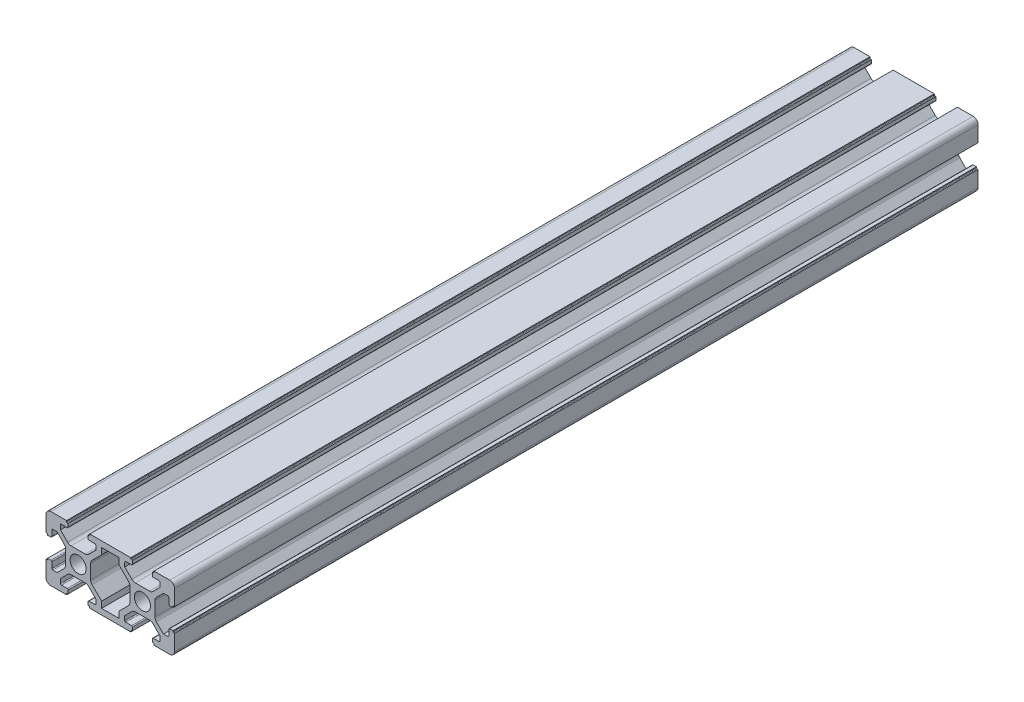
from build123d import *

# Parameters (mm, degrees)
SKETCH_1_R      = 2.5
EXTRUDE_1_DEPTH = 250


with BuildPart() as part:
    # 草图1 → 凸台-拉伸1 (new body)
    with BuildSketch(Plane.XY):
        with BuildLine():
            Line((-0.771587854, 9.545792426), (-5.671587854, 9.545792426))
            Line((-5.671587854, 9.545792426), (-5.671587854, 9.245792426))
            ThreePointArc((-5.671587854, 9.245792426), (-5.730166498, 9.10437107), (-5.871587854, 9.045792426))
            Line((-5.871587854, 9.045792426), (-6.171587854, 9.045792426))
            Line((-6.171587854, 9.045792426), (-6.171587854, 8.045792426))
            ThreePointArc((-6.171587854, 8.045792426), (-6.083719889, 7.833660392), (-5.871587854, 7.745792426))
            Line((-5.871587854, 7.745792426), (-4.071587854, 7.745792426))
            ThreePointArc((-4.071587854, 7.745792426), (-3.85945582, 7.657924461), (-3.771587854, 7.445792426))
            Line((-3.771587854, 7.445792426), (-3.771587854, 6.105792426))
            Line((-3.771587854, 6.105792426), (-5.992248026, 3.885132255))
            ThreePointArc((-5.992248026, 3.885132255), (-6.478883049, 3.559973128), (-7.052908198, 3.445792426))
            Line((-7.052908198, 3.445792426), (-11.490267511, 3.445792426))
            ThreePointArc((-11.490267511, 3.445792426), (-12.064292659, 3.559973128), (-12.550927682, 3.885132255))
            Line((-12.550927682, 3.885132255), (-14.771587854, 6.105792426))
            Line((-14.771587854, 6.105792426), (-14.771587854, 7.445792426))
            ThreePointArc((-14.771587854, 7.445792426), (-14.683719889, 7.657924461), (-14.471587854, 7.745792426))
            Line((-14.471587854, 7.745792426), (-12.671587854, 7.745792426))
            ThreePointArc((-12.671587854, 7.745792426), (-12.45945582, 7.833660392), (-12.371587854, 8.045792426))
            Line((-12.371587854, 8.045792426), (-12.371587854, 9.045792426))
            Line((-12.371587854, 9.045792426), (-12.671587854, 9.045792426))
            ThreePointArc((-12.671587854, 9.045792426), (-12.81300921, 9.10437107), (-12.871587854, 9.245792426))
            Line((-12.871587854, 9.245792426), (-12.871587854, 9.545792426))
            Line((-12.871587854, 9.545792426), (-17.771587854, 9.545792426))
            ThreePointArc((-17.771587854, 9.545792426), (-18.832248026, 9.106452598), (-19.271587854, 8.045792426))
            Line((-19.271587854, 8.045792426), (-19.271587854, 3.145792426))
            Line((-19.271587854, 3.145792426), (-18.971587854, 3.145792426))
            ThreePointArc((-18.971587854, 3.145792426), (-18.830166498, 3.087213783), (-18.771587854, 2.945792426))
            Line((-18.771587854, 2.945792426), (-18.771587854, 2.645792426))
            Line((-18.771587854, 2.645792426), (-17.771587854, 2.645792426))
            ThreePointArc((-17.771587854, 2.645792426), (-17.55945582, 2.733660392), (-17.471587854, 2.945792426))
            Line((-17.471587854, 2.945792426), (-17.471587854, 4.745792426))
            ThreePointArc((-17.471587854, 4.745792426), (-17.383719889, 4.957924461), (-17.171587854, 5.045792426))
            Line((-17.171587854, 5.045792426), (-15.831587854, 5.045792426))
            Line((-15.831587854, 5.045792426), (-13.610927682, 2.825132255))
            ThreePointArc((-13.610927682, 2.825132255), (-13.285768555, 2.338497231), (-13.171587854, 1.764472083))
            Line((-13.171587854, 1.764472083), (-13.171587854, -2.67288723))
            ThreePointArc((-13.171587854, -2.67288723), (-13.285768555, -3.246912379), (-13.610927682, -3.733547402))
            Line((-13.610927682, -3.733547402), (-15.831587854, -5.954207574))
            Line((-15.831587854, -5.954207574), (-17.171587854, -5.954207574))
            ThreePointArc((-17.171587854, -5.954207574), (-17.383719889, -5.866339608), (-17.471587854, -5.654207574))
            Line((-17.471587854, -5.654207574), (-17.471587854, -3.854207574))
            ThreePointArc((-17.471587854, -3.854207574), (-17.55945582, -3.642075539), (-17.771587854, -3.554207574))
            Line((-17.771587854, -3.554207574), (-18.771587854, -3.554207574))
            Line((-18.771587854, -3.554207574), (-18.771587854, -3.854207574))
            ThreePointArc((-18.771587854, -3.854207574), (-18.830166498, -3.99562893), (-18.971587854, -4.054207574))
            Line((-18.971587854, -4.054207574), (-19.271587854, -4.054207574))
            Line((-19.271587854, -4.054207574), (-19.271587854, -8.954207574))
            ThreePointArc((-19.271587854, -8.954207574), (-18.832248026, -10.014867745), (-17.771587854, -10.454207574))
            Line((-17.771587854, -10.454207574), (-12.871587854, -10.454207574))
            Line((-12.871587854, -10.454207574), (-12.871587854, -10.154207574))
            ThreePointArc((-12.871587854, -10.154207574), (-12.81300921, -10.012786217), (-12.671587854, -9.954207574))
            Line((-12.671587854, -9.954207574), (-12.371587854, -9.954207574))
            Line((-12.371587854, -9.954207574), (-12.371587854, -8.954207574))
            ThreePointArc((-12.371587854, -8.954207574), (-12.45945582, -8.742075539), (-12.671587854, -8.654207574))
            Line((-12.671587854, -8.654207574), (-14.471587854, -8.654207574))
            ThreePointArc((-14.471587854, -8.654207574), (-14.683719889, -8.566339608), (-14.771587854, -8.354207574))
            Line((-14.771587854, -8.354207574), (-14.771587854, -7.014207574))
            Line((-14.771587854, -7.014207574), (-12.550927682, -4.793547402))
            ThreePointArc((-12.550927682, -4.793547402), (-12.064292659, -4.468388275), (-11.490267511, -4.354207574))
            Line((-11.490267511, -4.354207574), (-7.052908198, -4.354207574))
            ThreePointArc((-7.052908198, -4.354207574), (-6.478883049, -4.468388275), (-5.992248026, -4.793547402))
            Line((-5.992248026, -4.793547402), (-3.771587854, -7.014207574))
            Line((-3.771587854, -7.014207574), (-3.771587854, -8.354207574))
            ThreePointArc((-3.771587854, -8.354207574), (-3.85945582, -8.566339608), (-4.071587854, -8.654207574))
            Line((-4.071587854, -8.654207574), (-5.871587854, -8.654207574))
            ThreePointArc((-5.871587854, -8.654207574), (-6.083719889, -8.742075539), (-6.171587854, -8.954207574))
            Line((-6.171587854, -8.954207574), (-6.171587854, -9.954207574))
            Line((-6.171587854, -9.954207574), (-5.871587854, -9.954207574))
            ThreePointArc((-5.871587854, -9.954207574), (-5.730166498, -10.012786217), (-5.671587854, -10.154207574))
            Line((-5.671587854, -10.154207574), (-5.671587854, -10.454207574))
            Line((-5.671587854, -10.454207574), (-0.771587854, -10.454207574))
            Line((-0.771587854, -10.454207574), (7.128412146, -10.454207574))
            Line((7.128412146, -10.454207574), (7.128412146, -10.154207574))
            ThreePointArc((7.128412146, -10.154207574), (7.18699079, -10.012786217), (7.328412146, -9.954207574))
            Line((7.328412146, -9.954207574), (7.628412146, -9.954207574))
            Line((7.628412146, -9.954207574), (7.628412146, -8.954207574))
            ThreePointArc((7.628412146, -8.954207574), (7.54054418, -8.742075539), (7.328412146, -8.654207574))
            Line((7.328412146, -8.654207574), (5.528412146, -8.654207574))
            ThreePointArc((5.528412146, -8.654207574), (5.316280111, -8.566339608), (5.228412146, -8.354207574))
            Line((5.228412146, -8.354207574), (5.228412146, -7.014207574))
            Line((5.228412146, -7.014207574), (7.449072318, -4.793547402))
            ThreePointArc((7.449072318, -4.793547402), (7.935707341, -4.468388275), (8.509732489, -4.354207574))
            Line((8.509732489, -4.354207574), (12.947091802, -4.354207574))
            ThreePointArc((12.947091802, -4.354207574), (13.521116951, -4.468388275), (14.007751974, -4.793547402))
            Line((14.007751974, -4.793547402), (16.228412146, -7.014207574))
            Line((16.228412146, -7.014207574), (16.228412146, -8.354207574))
            ThreePointArc((16.228412146, -8.354207574), (16.14054418, -8.566339608), (15.928412146, -8.654207574))
            Line((15.928412146, -8.654207574), (14.128412146, -8.654207574))
            ThreePointArc((14.128412146, -8.654207574), (13.916280111, -8.742075539), (13.828412146, -8.954207574))
            Line((13.828412146, -8.954207574), (13.828412146, -9.954207574))
            Line((13.828412146, -9.954207574), (14.128412146, -9.954207574))
            ThreePointArc((14.128412146, -9.954207574), (14.269833502, -10.012786217), (14.328412146, -10.154207574))
            Line((14.328412146, -10.154207574), (14.328412146, -10.454207574))
            Line((14.328412146, -10.454207574), (19.228412146, -10.454207574))
            ThreePointArc((19.228412146, -10.454207574), (20.289072318, -10.014867745), (20.728412146, -8.954207574))
            Line((20.728412146, -8.954207574), (20.728412146, -4.054207574))
            Line((20.728412146, -4.054207574), (20.428412146, -4.054207574))
            ThreePointArc((20.428412146, -4.054207574), (20.28699079, -3.99562893), (20.228412146, -3.854207574))
            Line((20.228412146, -3.854207574), (20.228412146, -3.554207574))
            Line((20.228412146, -3.554207574), (19.228412146, -3.554207574))
            ThreePointArc((19.228412146, -3.554207574), (19.016280111, -3.642075539), (18.928412146, -3.854207574))
            Line((18.928412146, -3.854207574), (18.928412146, -5.654207574))
            ThreePointArc((18.928412146, -5.654207574), (18.84054418, -5.866339608), (18.628412146, -5.954207574))
            Line((18.628412146, -5.954207574), (17.288412146, -5.954207574))
            Line((17.288412146, -5.954207574), (15.067751974, -3.733547402))
            ThreePointArc((15.067751974, -3.733547402), (14.742592847, -3.246912379), (14.628412146, -2.67288723))
            Line((14.628412146, -2.67288723), (14.628412146, 1.764472083))
            ThreePointArc((14.628412146, 1.764472083), (14.742592847, 2.338497231), (15.067751974, 2.825132255))
            Line((15.067751974, 2.825132255), (17.288412146, 5.045792426))
            Line((17.288412146, 5.045792426), (18.628412146, 5.045792426))
            ThreePointArc((18.628412146, 5.045792426), (18.84054418, 4.957924461), (18.928412146, 4.745792426))
            Line((18.928412146, 4.745792426), (18.928412146, 2.945792426))
            ThreePointArc((18.928412146, 2.945792426), (19.016280111, 2.733660392), (19.228412146, 2.645792426))
            Line((19.228412146, 2.645792426), (20.228412146, 2.645792426))
            Line((20.228412146, 2.645792426), (20.228412146, 2.945792426))
            ThreePointArc((20.228412146, 2.945792426), (20.28699079, 3.087213783), (20.428412146, 3.145792426))
            Line((20.428412146, 3.145792426), (20.728412146, 3.145792426))
            Line((20.728412146, 3.145792426), (20.728412146, 8.045792426))
            ThreePointArc((20.728412146, 8.045792426), (20.289072318, 9.106452598), (19.228412146, 9.545792426))
            Line((19.228412146, 9.545792426), (14.328412146, 9.545792426))
            Line((14.328412146, 9.545792426), (14.328412146, 9.245792426))
            ThreePointArc((14.328412146, 9.245792426), (14.269833502, 9.10437107), (14.128412146, 9.045792426))
            Line((14.128412146, 9.045792426), (13.828412146, 9.045792426))
            Line((13.828412146, 9.045792426), (13.828412146, 8.045792426))
            ThreePointArc((13.828412146, 8.045792426), (13.916280111, 7.833660392), (14.128412146, 7.745792426))
            Line((14.128412146, 7.745792426), (15.928412146, 7.745792426))
            ThreePointArc((15.928412146, 7.745792426), (16.14054418, 7.657924461), (16.228412146, 7.445792426))
            Line((16.228412146, 7.445792426), (16.228412146, 6.105792426))
            Line((16.228412146, 6.105792426), (14.007751974, 3.885132255))
            ThreePointArc((14.007751974, 3.885132255), (13.521116951, 3.559973128), (12.947091802, 3.445792426))
            Line((12.947091802, 3.445792426), (8.509732489, 3.445792426))
            ThreePointArc((8.509732489, 3.445792426), (7.935707341, 3.559973128), (7.449072318, 3.885132255))
            Line((7.449072318, 3.885132255), (5.228412146, 6.105792426))
            Line((5.228412146, 6.105792426), (5.228412146, 7.445792426))
            ThreePointArc((5.228412146, 7.445792426), (5.316280111, 7.657924461), (5.528412146, 7.745792426))
            Line((5.528412146, 7.745792426), (7.328412146, 7.745792426))
            ThreePointArc((7.328412146, 7.745792426), (7.54054418, 7.833660392), (7.628412146, 8.045792426))
            Line((7.628412146, 8.045792426), (7.628412146, 9.045792426))
            Line((7.628412146, 9.045792426), (7.328412146, 9.045792426))
            ThreePointArc((7.328412146, 9.045792426), (7.18699079, 9.10437107), (7.128412146, 9.245792426))
            Line((7.128412146, 9.245792426), (7.128412146, 9.545792426))
            Line((7.128412146, 9.545792426), (2.228412146, 9.545792426))
            Line((2.228412146, 9.545792426), (-0.771587854, 9.545792426))
        make_face()
        with Locations((10.728412146, -0.454207574)):
            Circle(SKETCH_1_R, mode=Mode.SUBTRACT)
        with Locations((-9.271587854, -0.454207574)):
            Circle(SKETCH_1_R, mode=Mode.SUBTRACT)
        with BuildLine():
            Line((-1.971587854, -6.694207574), (-4.932248026, -3.733547402))
            ThreePointArc((-4.932248026, -3.733547402), (-5.257407153, -3.246912379), (-5.371587854, -2.67288723))
            Line((-5.371587854, -2.67288723), (-5.371587854, 1.764472083))
            ThreePointArc((-5.371587854, 1.764472083), (-5.257407153, 2.338497231), (-4.932248026, 2.825132255))
            Line((-4.932248026, 2.825132255), (-1.971587854, 5.785792426))
            Line((-1.971587854, 5.785792426), (-1.971587854, 7.745792426))
            Line((-1.971587854, 7.745792426), (3.428412146, 7.745792426))
            Line((3.428412146, 7.745792426), (3.428412146, 5.785792426))
            Line((3.428412146, 5.785792426), (6.389072318, 2.825132255))
            ThreePointArc((6.389072318, 2.825132255), (6.714231445, 2.338497231), (6.828412146, 1.764472083))
            Line((6.828412146, 1.764472083), (6.828412146, -2.67288723))
            ThreePointArc((6.828412146, -2.67288723), (6.714231445, -3.246912379), (6.389072318, -3.733547402))
            Line((6.389072318, -3.733547402), (3.428412146, -6.694207574))
            Line((3.428412146, -6.694207574), (3.428412146, -8.654207574))
            Line((3.428412146, -8.654207574), (-1.971587854, -8.654207574))
            Line((-1.971587854, -8.654207574), (-1.971587854, -6.694207574))
        make_face(mode=Mode.SUBTRACT)
    extrude(amount=EXTRUDE_1_DEPTH)


solid = part.part
